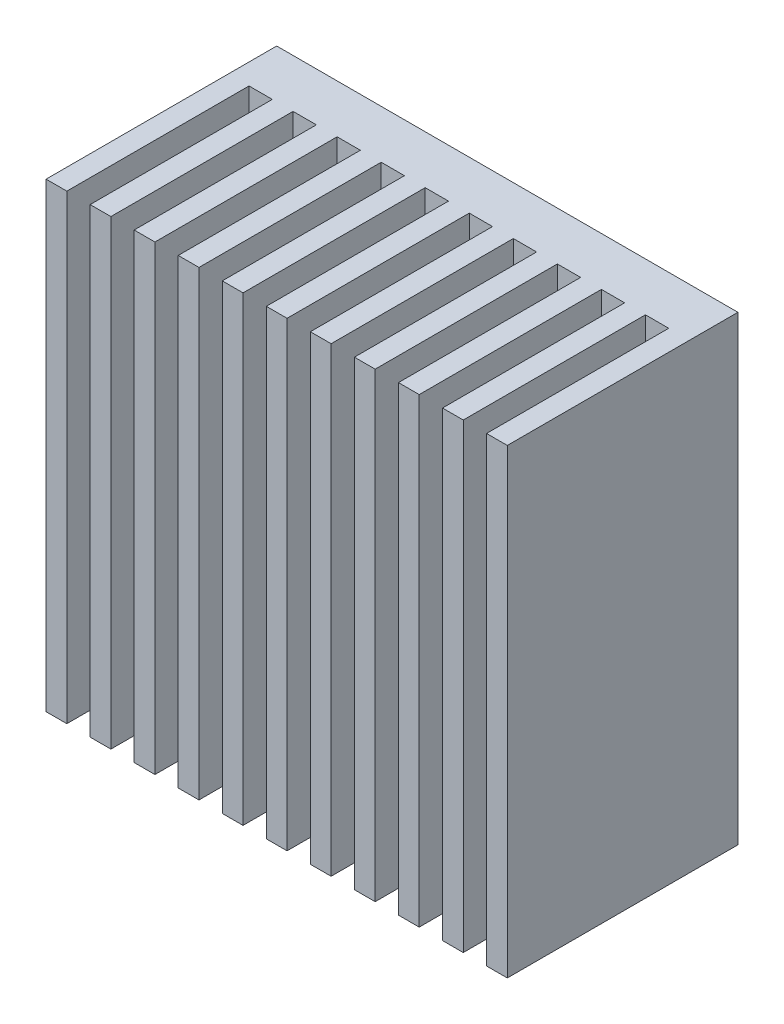
from build123d import *

# Parameters (mm, degrees)
ESQUISSE1_W                = 40
ESQUISSE1_H                = 40
BOSS_EXTRU_1_DEPTH         = 4.2
ESQUISSE2_W                = 1.8
ESQUISSE2_H                = 15.8
BOSS_EXTRU_2_DEPTH         = 40
R_P_TITION_LIN_AIRE1_COUNT = 11
R_P_TITION_LIN_AIRE1_PITCH = 3.82
ESQUISSE3_R                = 1.25
ENL_V_MAT_EXTRU_1_DEPTH    = 10


with BuildPart() as part:
    # Esquisse1 → Boss.-Extru.1 (new body)
    with BuildSketch(Plane.XY):
        with Locations((20, 20)):
            Rectangle(ESQUISSE1_W, ESQUISSE1_H)
    extrude(amount=BOSS_EXTRU_1_DEPTH)

    # Esquisse2 → Boss.-Extru.2 (add)
    with BuildSketch(Plane.XZ):
        with Locations((0.9, 12.1)):
            Rectangle(ESQUISSE2_W, ESQUISSE2_H)
    boss_extru_2 = extrude(amount=-BOSS_EXTRU_2_DEPTH)

    # Répétition linéaire1: Boss.-Extru.2 ×11
    with Locations(*[(i * R_P_TITION_LIN_AIRE1_PITCH, 0, 0) for i in range(1, R_P_TITION_LIN_AIRE1_COUNT)]):
        add(boss_extru_2)

    # Esquisse3 → Enlèv. mat.-Extru.1 (cut)
    with BuildSketch(Plane(origin=(0, 0, 0), x_dir=(-1, 0, 0), z_dir=(0, 0, -1))):
        with Locations((-30, 20)):
            Circle(ESQUISSE3_R)
        with Locations((-10, 20)):
            Circle(ESQUISSE3_R)
    extrude(amount=-ENL_V_MAT_EXTRU_1_DEPTH, mode=Mode.SUBTRACT)


solid = part.part
